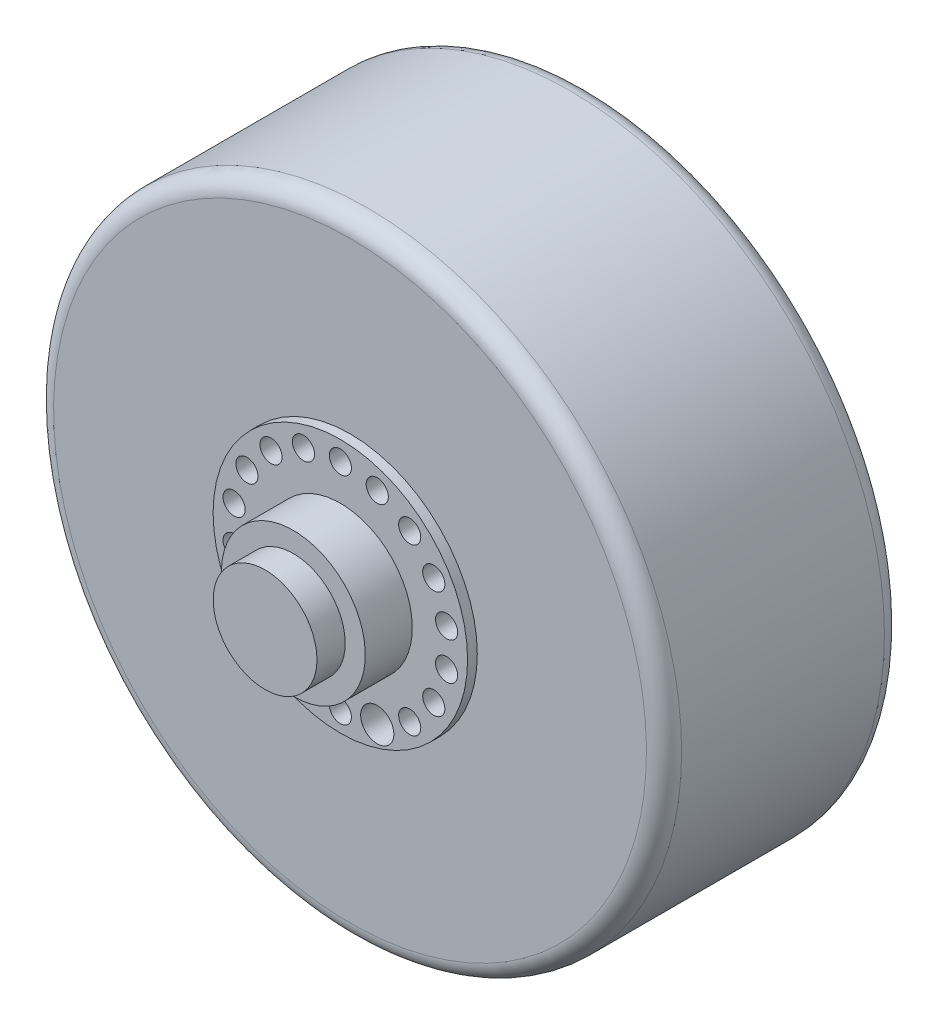
from build123d import *

# Parameters (mm, degrees)
SKETCH1_W          = 10.2108
SKETCH1_H          = 18.7452
SKETCH2_R          = 4
CUT_EXTRUDE1_DEPTH = 9.525
CIRPATTERN1_COUNT  = 18
SKETCH4_R          = 6
CUT_EXTRUDE2_DEPTH = 9.525
FILLET1_R          = 6.35
SKETCH5_R          = 4
SKETCH5_R_2        = 27.94
SKETCH5_R_3        = 24.5
CUT_EXTRUDE3_DEPTH = 9.525


with BuildPart() as part:
    # Sketch1 → Revolve1 (revolve)
    with BuildSketch(Plane(origin=(0, 0, 0), x_dir=(0, 0, -1), z_dir=(1, 0, 0)), mode=Mode.PRIVATE) as revolve1_sk:
        with Locations((-82.1309, 9.3726)):
            Rectangle(SKETCH1_W, SKETCH1_H)
        Polygon((-77.0255, 18.7452), (-77.0255, 0), (-60.0329, 0), (-60.0329, 26.0096), (-77.0255, 26.0096), align=None)
        Polygon((-60.0329, 26.0096), (-60.0329, 0), (-56.5277, 0), (-56.5277, 45.9994), (-60.0329, 45.9994), align=None)
        Polygon((-56.5277, 45.9994), (-56.5277, 0), (29.4767, 0), (29.4767, 46.99), (29.4767, 113.5126), (-56.5277, 113.5126), align=None)
    revolve(revolve1_sk.sketch.rotate(Axis((0, 0, 87.2363), (0, 0, -1)), 180), axis=Axis((0, 0, 87.2363), (0, 0, -1)))

    # Sketch2 → Cut-Extrude1 (cut)
    with BuildSketch(Plane.XY.offset(60.0329)):
        with Locations((0, 39)):
            Circle(SKETCH2_R)
    cut_extrude1 = extrude(amount=-CUT_EXTRUDE1_DEPTH, mode=Mode.SUBTRACT)

    # CirPattern1: Cut-Extrude1 ×18 about axis, 2 skipped
    cirpattern1_axis = Axis((0, 0, 0), (0, 0, -1))
    add([cut_extrude1.rotate(cirpattern1_axis, i * 360 / CIRPATTERN1_COUNT) for i in range(1, CIRPATTERN1_COUNT) if i not in (8, 10)], mode=Mode.SUBTRACT)

    # Sketch4 → Cut-Extrude2 (cut)
    with BuildSketch(Plane.XY.offset(60.0329)):
        with Locations((-13.33878559, -36.648012211)):
            Circle(SKETCH4_R)
        with Locations((13.33878559, -36.648012211)):
            Circle(SKETCH4_R)
    extrude(amount=-CUT_EXTRUDE2_DEPTH, mode=Mode.SUBTRACT)

    # Fillet1
    fillet1_edges = [part.edges().sort_by_distance(p)[0] for p in [
        (0, 113.5126, 56.5277),
        (0, 113.5126, -29.4767),
    ]]
    fillet(fillet1_edges, radius=FILLET1_R)

    # Sketch5 → Cut-Extrude3 (cut)
    # profile 1 of 7: a face of its own
    with BuildSketch(Plane(origin=(0, 0, -29.4767), x_dir=(-1, 0, 0), z_dir=(0, 0, -1))):
        with Locations(Location((0, 37.5, 0), (0, 0, 90))):
            Circle(SKETCH5_R)
    # profile 2 of 7: a face of its own
    with BuildSketch(Plane(origin=(0, 0, -29.4767), x_dir=(-1, 0, 0), z_dir=(0, 0, -1))):
        with Locations(Location((32.475952642, 18.75, 0), (0, 0, 90))):
            Circle(SKETCH5_R)
    # profile 3 of 7: a face of its own
    with BuildSketch(Plane(origin=(0, 0, -29.4767), x_dir=(-1, 0, 0), z_dir=(0, 0, -1))):
        with Locations(Location((32.475952642, -18.75, 0), (0, 0, 90))):
            Circle(SKETCH5_R)
    # profile 4 of 7: a face of its own
    with BuildSketch(Plane(origin=(0, 0, -29.4767), x_dir=(-1, 0, 0), z_dir=(0, 0, -1))):
        with Locations(Location((0, -37.5, 0), (0, 0, 90))):
            Circle(SKETCH5_R)
    # profile 5 of 7: a face of its own
    with BuildSketch(Plane(origin=(0, 0, -29.4767), x_dir=(-1, 0, 0), z_dir=(0, 0, -1))):
        with Locations(Location((-32.475952642, -18.75, 0), (0, 0, 90))):
            Circle(SKETCH5_R)
    # profile 6 of 7: a face of its own
    with BuildSketch(Plane(origin=(0, 0, -29.4767), x_dir=(-1, 0, 0), z_dir=(0, 0, -1))):
        with Locations(Location((-32.475952642, 18.75, 0), (0, 0, 90))):
            Circle(SKETCH5_R)
    # profile 7 of 7: a face of its own
    with BuildSketch(Plane(origin=(0, 0, -29.4767), x_dir=(-1, 0, 0), z_dir=(0, 0, -1))):
        with Locations(Location((0, 0, 0), (0, 0, 90))):
            Circle(SKETCH5_R_2)
        with Locations(Location((0, 0, 0), (0, 0, 90))):
            Circle(SKETCH5_R_3, mode=Mode.SUBTRACT)
    extrude(amount=-CUT_EXTRUDE3_DEPTH, mode=Mode.SUBTRACT)


solid = part.part
